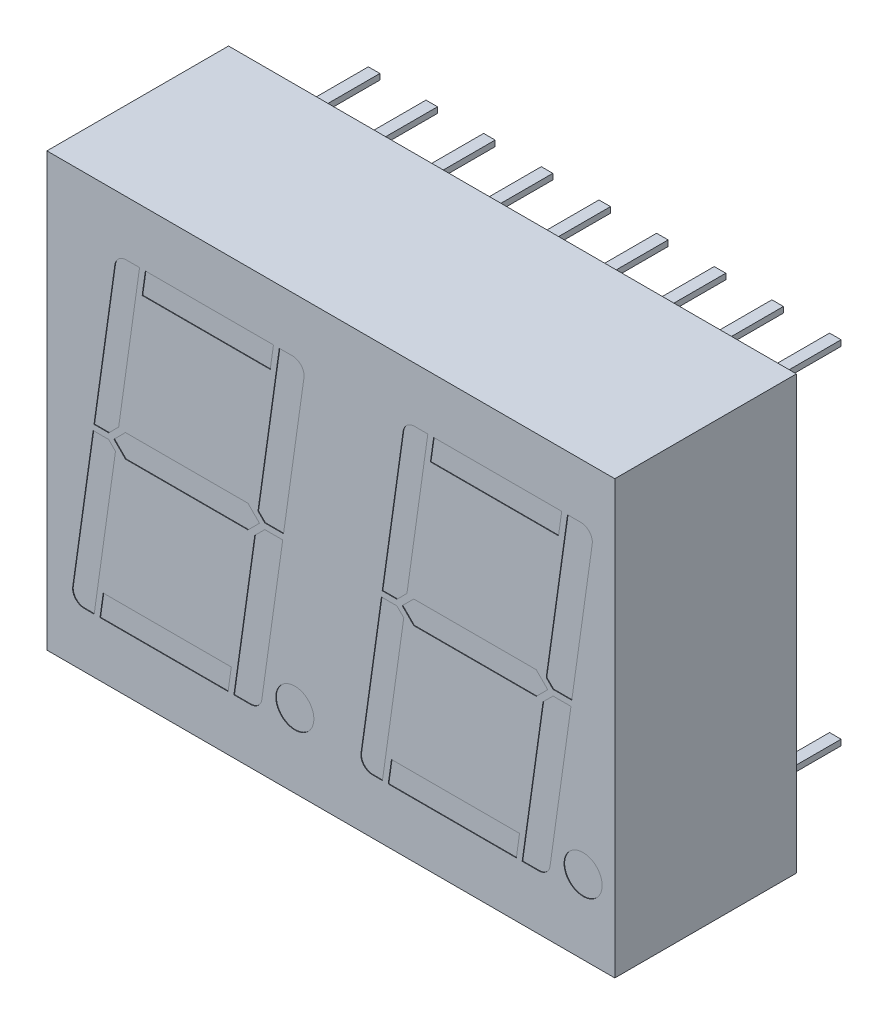
from build123d import *

# Parameters (mm, degrees)
SKETCH1_W            = 25.019
SKETCH1_H            = 19.05
BOSS_EXTRUDE1_DEPTH  = 8.001
SKETCH2_W            = 0.508
SKETCH2_H            = 0.254
BOSS_EXTRUDE2_DEPTH  = 4.064
LPATTERN1_COUNT      = 5
LPATTERN1_PITCH      = 2.54
LPATTERN1_COUNT_DIR2 = 2
LPATTERN1_PITCH_DIR2 = 15.24
LPATTERN2_COUNT      = 5
LPATTERN2_PITCH      = 2.54
LPATTERN2_COUNT_DIR2 = 2
LPATTERN2_PITCH_DIR2 = 15.24
SKETCH4_R            = 0.8382
CUT_EXTRUDE1_DEPTH   = 0.0254
LPATTERN3_COUNT      = 2
LPATTERN3_PITCH      = 12.7


with BuildPart() as part:
    # Sketch1 → Boss-Extrude1 (new body)
    with BuildSketch(Plane.XY):
        Rectangle(SKETCH1_W, SKETCH1_H)
    extrude(amount=BOSS_EXTRUDE1_DEPTH)

    # Sketch2 → Boss-Extrude2 (add)
    with BuildSketch(Plane(origin=(0, 0, 0), x_dir=(-1, 0, 0), z_dir=(0, 0, -1))):
        with Locations((0, 7.62)):
            Rectangle(SKETCH2_W, SKETCH2_H)
    boss_extrude2 = extrude(amount=BOSS_EXTRUDE2_DEPTH)

    # LPattern1: Boss-Extrude2 5 × 2
    with Locations(*[(-i * LPATTERN1_PITCH, -j * LPATTERN1_PITCH_DIR2, 0) for i in range(LPATTERN1_COUNT) for j in range(LPATTERN1_COUNT_DIR2) if (i, j) != (0, 0)]):
        add(boss_extrude2)

    # LPattern2: Boss-Extrude2 5 × 2
    with Locations(*[(i * LPATTERN2_PITCH, -j * LPATTERN2_PITCH_DIR2, 0) for i in range(LPATTERN2_COUNT) for j in range(LPATTERN2_COUNT_DIR2) if (i, j) != (0, 0)]):
        add(boss_extrude2)

    # Sketch4 → Cut-Extrude1 (cut)
    with BuildSketch(Plane.XY.offset(8.001)):
        with Locations((-1.5875, -6.2738)):
            Circle(SKETCH4_R)
        Polygon((-9.556202543, 0), (-9.048202543, 0.508), (-3.651797457, 0.508), (-3.143797457, 0), (-3.651797457, -0.508), (-9.048202543, -0.508), align=None)
        with BuildLine():
            Line((-9.788412788, 0.127), (-9.348244077, 0.567168711))
            Line((-9.348244077, 0.567168711), (-8.428428025, 7.112))
            Line((-8.428428025, 7.112), (-9.012815176, 7.112))
            ThreePointArc((-9.012815176, 7.112), (-9.346093162, 6.987392467), (-9.515871354, 6.674699935))
            Line((-9.515871354, 6.674699935), (-10.436090569, 0.127))
            Line((-10.436090569, 0.127), (-9.788412788, 0.127))
        make_face()
        Polygon((-5.350473584, 7.112), (-8.171931821, 7.112), (-8.313331692, 6.105887642), (-5.491873454, 6.105887642), (-2.670415217, 6.105887642), (-2.529015346, 7.112), align=None)
        with BuildLine():
            Line((-2.085422571, 0.127), (-2.911587212, 0.127))
            Line((-2.911587212, 0.127), (-3.211979491, 0.427392279))
            Line((-3.211979491, 0.427392279), (-2.272519143, 7.112))
            Line((-2.272519143, 7.112), (-1.688131992, 7.112))
            ThreePointArc((-1.688131992, 7.112), (-1.304739525, 6.937277987), (-1.185075813, 6.533300065))
            Line((-1.185075813, 6.533300065), (-2.085422571, 0.127))
        make_face()
        with BuildLine():
            Line((-3.544395336, -7.112), (-4.271571975, -7.112))
            Line((-4.271571975, -7.112), (-3.351755923, -0.567168711))
            Line((-3.351755923, -0.567168711), (-2.911587212, -0.127))
            Line((-2.911587212, -0.127), (-2.121119943, -0.127))
            Line((-2.121119943, -0.127), (-3.041339158, -6.674699935))
            ThreePointArc((-3.041339158, -6.674699935), (-3.21111735, -6.987392467), (-3.544395336, -7.112))
        make_face()
        with BuildLine():
            Line((-10.471787941, -0.127), (-9.788412788, -0.127))
            Line((-9.788412788, -0.127), (-9.488020509, -0.427392279))
            Line((-9.488020509, -0.427392279), (-10.427480857, -7.112))
            Line((-10.427480857, -7.112), (-10.86907852, -7.112))
            ThreePointArc((-10.86907852, -7.112), (-11.252470987, -6.937277987), (-11.372134699, -6.533300065))
            Line((-11.372134699, -6.533300065), (-10.471787941, -0.127))
        make_face()
        Polygon((-7.208126546, -6.105887642), (-10.029584783, -6.105887642), (-10.170984654, -7.112), (-7.349526416, -7.112), (-4.528068179, -7.112), (-4.386668308, -6.105887642), align=None)
    cut_extrude1 = extrude(amount=-CUT_EXTRUDE1_DEPTH, mode=Mode.SUBTRACT)

    # LPattern3: Cut-Extrude1 ×2
    with Locations(*[(i * LPATTERN3_PITCH, 0, 0) for i in range(1, LPATTERN3_COUNT)]):
        add(cut_extrude1, mode=Mode.SUBTRACT)


solid = part.part
